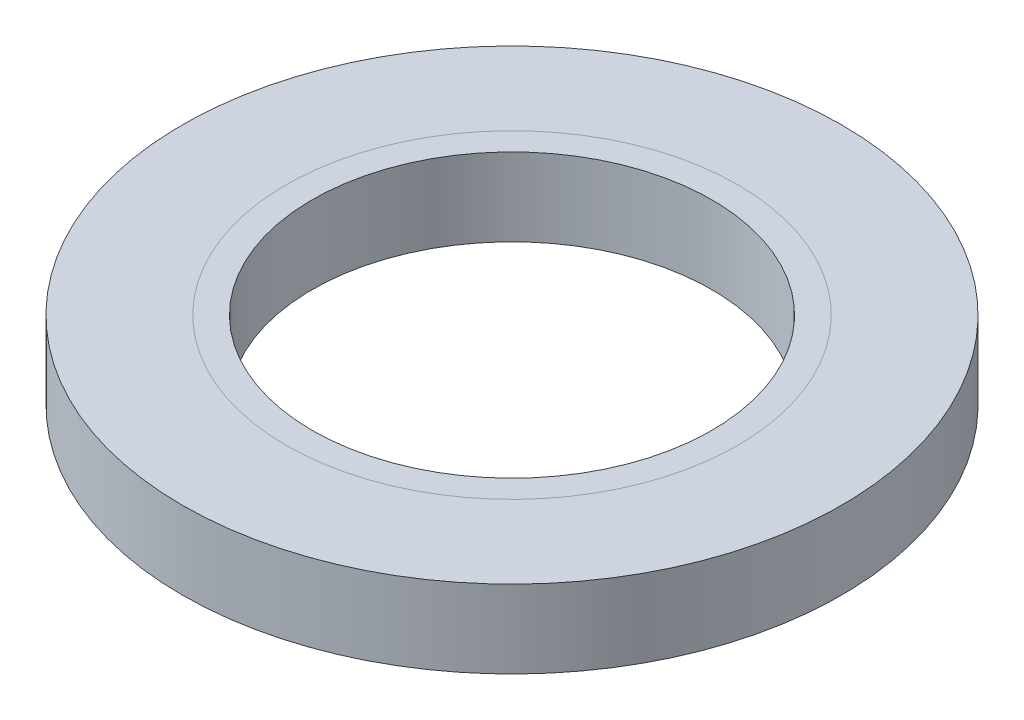
from build123d import *

# Parameters (mm, degrees)
SKETCH_2_R      = 43.5
SKETCH_2_R_2    = 38.5
EXTRUDE_1_DEPTH = 7.5
SKETCH_3_R      = 63.5
SKETCH_3_R_2    = 43.5
EXTRUDE_2_DEPTH = 7.5


with BuildPart() as part:
    # 草图2 → 凸台-拉伸1 (new, symmetric)
    with BuildSketch(Plane(origin=(0, 0, 0), x_dir=(1, 0, 0), z_dir=(0, 1, 0))):
        with Locations(Location((0, 0, 0), (0, 0, 270))):
            Circle(SKETCH_2_R)
        with Locations(Location((0, 0, 0), (0, 0, 270))):
            Circle(SKETCH_2_R_2, mode=Mode.SUBTRACT)
    extrude(amount=EXTRUDE_1_DEPTH, both=True)


with BuildPart() as body_2:
    # 草图3 → 凸台-拉伸2 (new, symmetric)
    with BuildSketch(Plane(origin=(0, 0, 0), x_dir=(1, 0, 0), z_dir=(0, 1, 0))):
        with Locations(Location((0, 0, 0), (0, 0, 270))):
            Circle(SKETCH_3_R)
        with Locations(Location((0, 0, 0), (0, 0, 270))):
            Circle(SKETCH_3_R_2, mode=Mode.SUBTRACT)
    extrude(amount=EXTRUDE_2_DEPTH, both=True)


solid = Compound([part.part, body_2.part])
